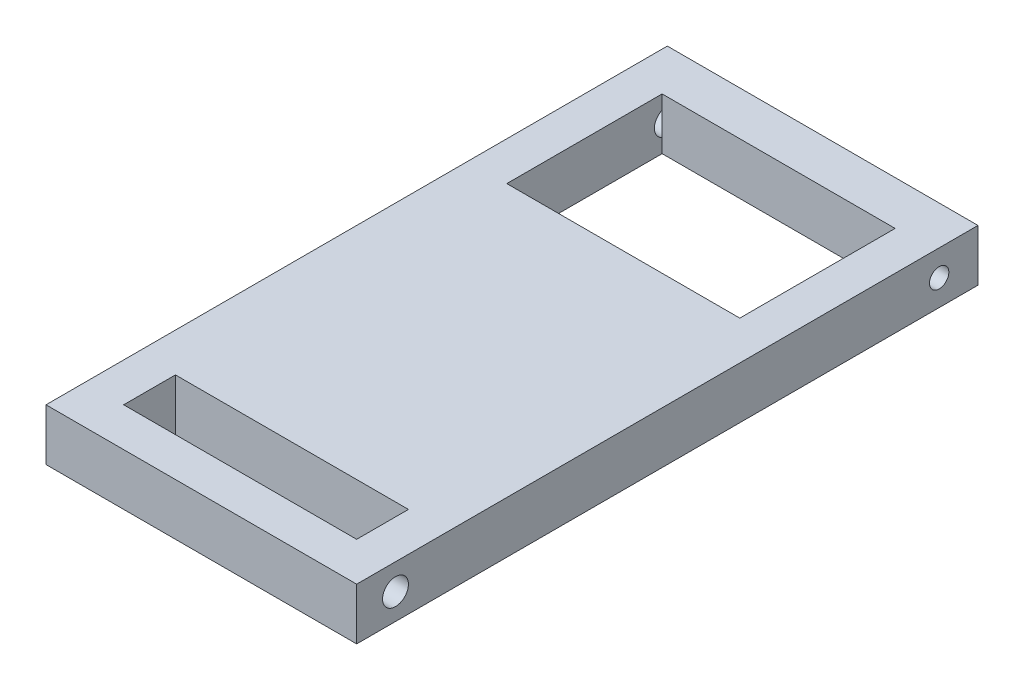
from build123d import *

# Parameters (mm, degrees)
SKETCH1_W           = 152.4
SKETCH1_H           = 304.8
BOSS_EXTRUDE1_DEPTH = 25.4
SKETCH2_R           = 6.35
CUT_EXTRUDE1_DEPTH  = 19.05
SKETCH3_R           = 4.741125957
CUT_EXTRUDE2_DEPTH  = 19.05
CUT_EXTRUDE3_START  = -19.05
SKETCH8_R           = 6.35
CUT_EXTRUDE3_DEPTH  = 19.05
SKETCH9_W           = 114.3
SKETCH9_H           = 25.4
SKETCH9_H_2         = 76.2
CUT_EXTRUDE5_DEPTH  = 27.94


with BuildPart() as part:
    # Sketch1 → Boss-Extrude1 (new body)
    with BuildSketch(Plane(origin=(0, 0, 0), x_dir=(1, 0, 0), z_dir=(0, 1, 0))):
        with Locations((76.2, 152.4)):
            Rectangle(SKETCH1_W, SKETCH1_H)
    extrude(amount=BOSS_EXTRUDE1_DEPTH)

    # Sketch2 → Cut-Extrude1 (cut)
    with BuildSketch(Plane(origin=(152.4, 0, 0), x_dir=(0, 0, -1), z_dir=(1, 0, 0))):
        with Locations((19.05, 12.7)):
            Circle(SKETCH2_R)
    extrude(amount=-CUT_EXTRUDE1_DEPTH, mode=Mode.SUBTRACT)

    # Sketch3 → Cut-Extrude2 (cut)
    with BuildSketch(Plane(origin=(152.4, 0, 0), x_dir=(0, 0, -1), z_dir=(1, 0, 0))):
        with Locations((285.75, 12.7)):
            Circle(SKETCH3_R)
    extrude(amount=-CUT_EXTRUDE2_DEPTH, mode=Mode.SUBTRACT)

    # Sketch8 → Cut-Extrude3 (cut)
    with BuildSketch(Plane.ZY.offset(CUT_EXTRUDE3_START)):
        with Locations((-285.75, 12.7)):
            Circle(SKETCH8_R)
        with Locations(Location((-19.05, 12.7, 0), (0, 0, 180))):
            Circle(SKETCH8_R)
    extrude(amount=CUT_EXTRUDE3_DEPTH, mode=Mode.SUBTRACT)

    # Sketch9 → Cut-Extrude5 (cut)
    with BuildSketch(Plane(origin=(0, 0, 0), x_dir=(1, 0, 0), z_dir=(0, 1, 0))):
        with Locations((76.2, 31.75)):
            Rectangle(SKETCH9_W, SKETCH9_H)
        with Locations((76.2, 245.100072294)):
            Rectangle(SKETCH9_W, SKETCH9_H_2)
    extrude(amount=CUT_EXTRUDE5_DEPTH, mode=Mode.SUBTRACT)


solid = part.part
